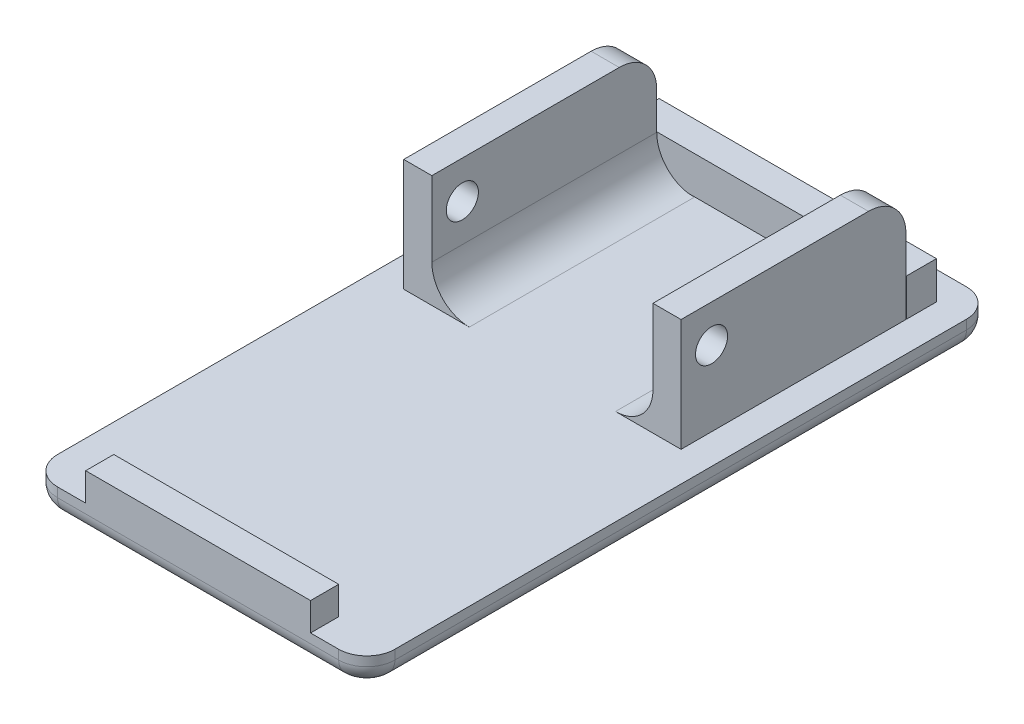
from build123d import *

# Parameters (mm, degrees)
SKETCH_1_W          = 18
SKETCH_1_H          = 33.5
EXTRUDE_1_DEPTH     = 1.5
FILLET_1_R          = 1.5
SKETCH_2_W          = 1.5
SKETCH_2_H          = 12
EXTRUDE_2_DEPTH     = 6
SKETCH_3_W          = 14.8
SKETCH_3_H          = 1.6
EXTRUDE_3_DEPTH     = 2
FILLET_2_R          = 2
SKETCH_4_R          = 0.856485036
CUT_EXTRUDE_1_DEPTH = 18
SKETCH_5_W          = 12
SKETCH_5_H          = 1.5
EXTRUDE_4_DEPTH     = 1.5
FILLET_3_R          = 1


with BuildPart() as part:
    # 草图1 → 凸台-拉伸1 (new body)
    with BuildSketch(Plane(origin=(0, 0, 0), x_dir=(1, 0, 0), z_dir=(0, 1, 0))):
        Rectangle(SKETCH_1_W, SKETCH_1_H)
    extrude(amount=EXTRUDE_1_DEPTH)

    # 圆角1
    fillet_1_edges = [part.edges().sort_by_distance(p)[0] for p in [
        (-9, 0.75, -16.75),
        (9, 0.75, -16.75),
        (9, 0.75, 16.75),
        (-9, 0.75, 16.75),
    ]]
    fillet(fillet_1_edges, radius=FILLET_1_R)

    # 草图2 → 凸台-拉伸2 (add)
    with BuildSketch(Plane(origin=(0, 1.5, 0), x_dir=(1, 0, 0), z_dir=(0, 1, 0))):
        with Locations((-6.65, 7.622409508)):
            Rectangle(SKETCH_2_W, SKETCH_2_H)
        with Locations((6.65, 7.622409508)):
            Rectangle(SKETCH_2_W, SKETCH_2_H)
    extrude(amount=EXTRUDE_2_DEPTH)

    # 草图3 → 凸台-拉伸3 (add)
    with BuildSketch(Plane(origin=(0, 1.5, 0), x_dir=(1, 0, 0), z_dir=(0, 1, 0))):
        with Locations((0, 14.45)):
            Rectangle(SKETCH_3_W, SKETCH_3_H)
    extrude(amount=EXTRUDE_3_DEPTH)

    # 圆角2
    fillet_2_edges = [part.edges().sort_by_distance(p)[0] for p in [
        (-5.9, 1.5, -7.622409508),
        (-6.65, 7.5, -13.622409508),
        (5.9, 1.5, -7.622409508),
        (6.65, 7.5, -13.622409508),
    ]]
    fillet(fillet_2_edges, radius=FILLET_2_R)

    # 草图4 → 切除-拉伸1 (cut)
    with BuildSketch(Plane(origin=(7.4, 0, 0), x_dir=(0, 0, -1), z_dir=(1, 0, 0))):
        with Locations((3.25, 5.5)):
            Circle(SKETCH_4_R)
    extrude(amount=-CUT_EXTRUDE_1_DEPTH, mode=Mode.SUBTRACT)

    # 草图5 → 凸台-拉伸4 (add)
    with BuildSketch(Plane(origin=(0, 1.5, 0), x_dir=(1, 0, 0), z_dir=(0, 1, 0))):
        with Locations((0, -16)):
            Rectangle(SKETCH_5_W, SKETCH_5_H)
    extrude(amount=EXTRUDE_4_DEPTH)

    # 圆角3
    fillet_3_edges = [part.edges().sort_by_distance(p)[0] for p in [
        (9, 0, 0),
        (-9, 0, 0),
        (0, 0, -16.75),
        (0, 0, 16.75),
        (-8.560660172, 0, -16.310660172),
        (8.560660172, 0, -16.310660172),
        (-8.560660172, 0, 16.310660172),
        (8.560660172, 0, 16.310660172),
    ]]
    fillet(fillet_3_edges, radius=FILLET_3_R)


solid = part.part
